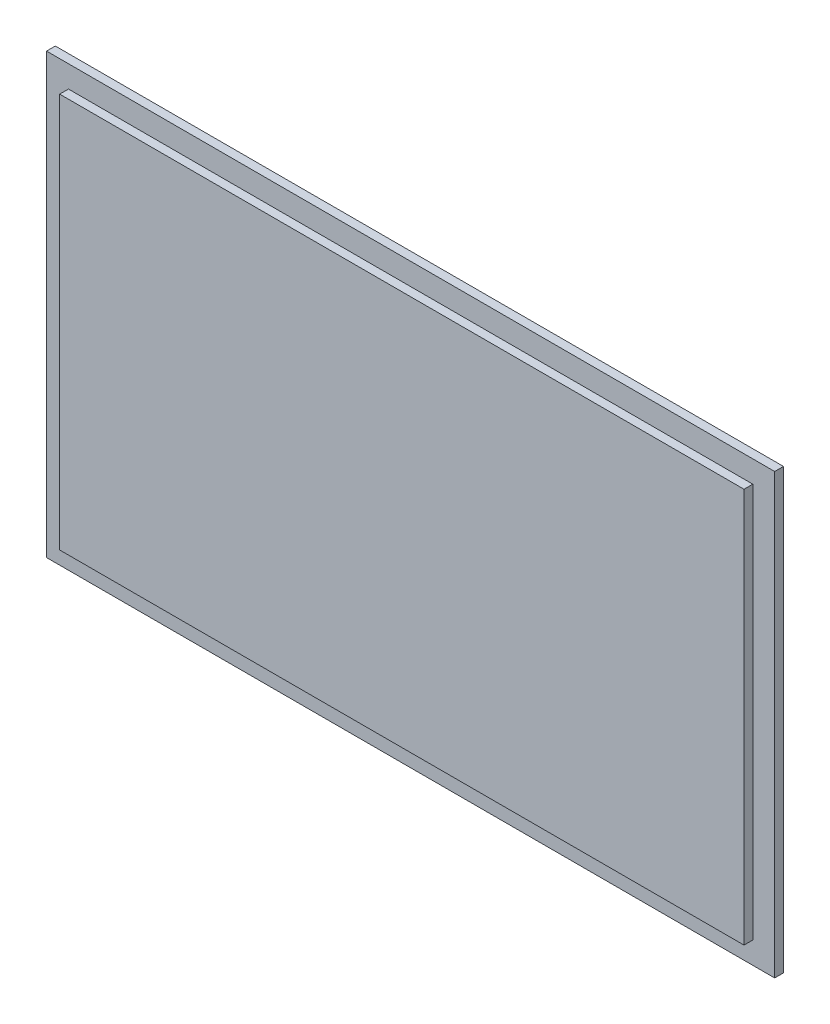
from build123d import *

# Parameters (mm, degrees)
SKETCH1_W           = 156
SKETCH1_H           = 90
BOSS_EXTRUDE1_DEPTH = 2
SKETCH2_W           = 166
SKETCH2_H           = 100
SKETCH2_W_2         = 156
SKETCH2_H_2         = 90
BOSS_EXTRUDE2_DEPTH = 2


with BuildPart() as part:
    # Sketch1 → Boss-Extrude1 (new body)
    with BuildSketch(Plane.XY):
        Rectangle(SKETCH1_W, SKETCH1_H)
    extrude(amount=BOSS_EXTRUDE1_DEPTH)


with BuildPart() as body_2:
    # Sketch2 → Boss-Extrude2 (new body)
    with BuildSketch(Plane(origin=(0, 0, 0), x_dir=(-1, 0, 0), z_dir=(0, 0, -1))):
        Rectangle(SKETCH2_W, SKETCH2_H)
        Rectangle(SKETCH2_W_2, SKETCH2_H_2, mode=Mode.SUBTRACT)
    extrude(amount=BOSS_EXTRUDE2_DEPTH)


solid = Compound([part.part, body_2.part])
